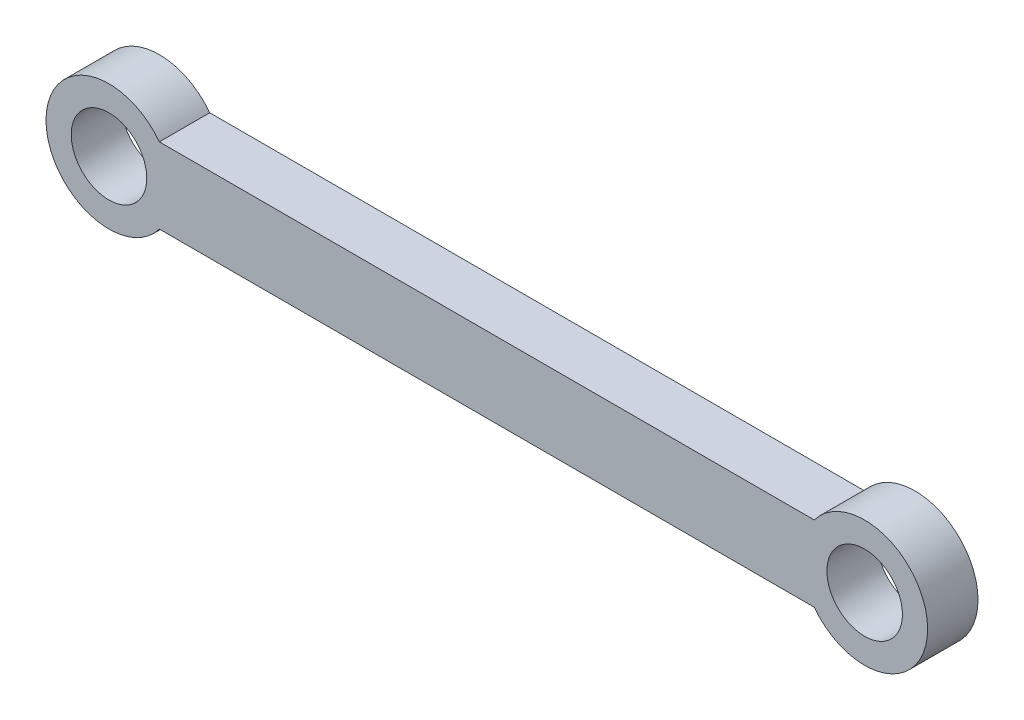
from build123d import *

# Parameters (mm, degrees)
SKETCH_1_R      = 1.5
EXTRUDE_1_DEPTH = 2


with BuildPart() as part:
    # 스케치1 → 보스-돌출1 (new body)
    with BuildSketch(Plane.XY):
        with BuildLine():
            Line((-13, -1.5), (13, -1.5))
            ThreePointArc((13, -1.5), (17.5, 0), (13, 1.5))
            Line((13, 1.5), (-13, 1.5))
            ThreePointArc((-13, 1.5), (-17.5, 0), (-13, -1.5))
        make_face()
        with Locations((-15, 0)):
            Circle(SKETCH_1_R, mode=Mode.SUBTRACT)
        with Locations((15, 0)):
            Circle(SKETCH_1_R, mode=Mode.SUBTRACT)
    extrude(amount=EXTRUDE_1_DEPTH)


solid = part.part
